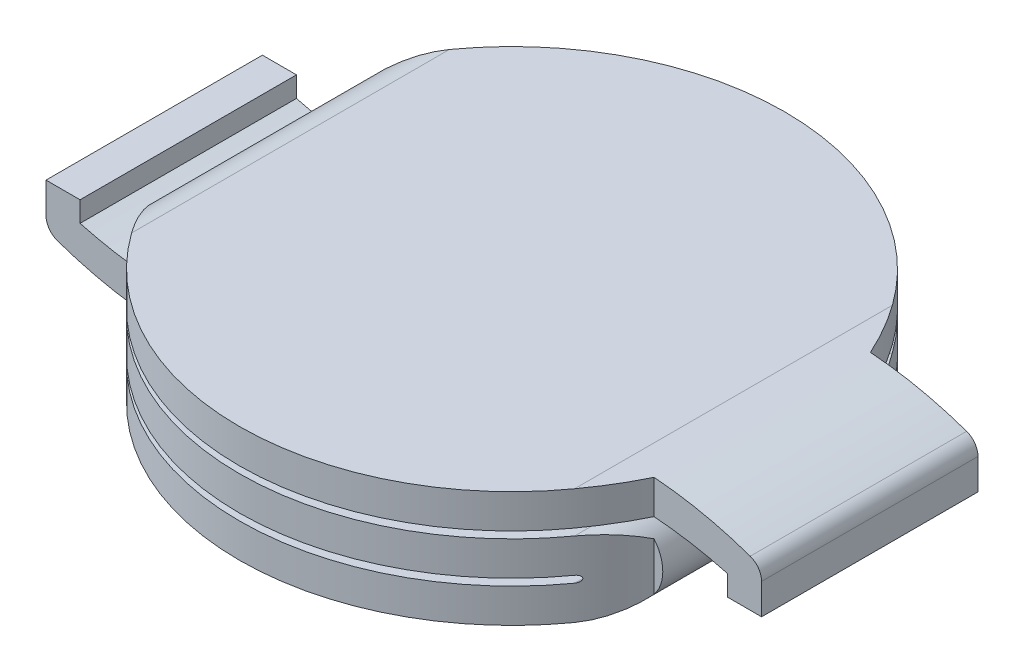
from build123d import *

# Parameters (mm, degrees)
BOSS_EXTRUDE1_DEPTH     = 16
CUT_EXTRUDE2_DEPTH      = 16
CUT_EXTRUDE2_DEPTH_BACK = 16
SKETCH2_R               = 16.202009592


with BuildPart() as part:
    # Sketch1 → Boss-Extrude1 (new body)
    with BuildSketch(Plane.XY):
        with BuildLine():
            Line((-6.5, -1.7), (6.5, -1.7))
            ThreePointArc((6.5, -1.7), (7.6, -0.6), (6.5, 0.5))
            Line((6.5, 0.5), (-6.5, 0.5))
            ThreePointArc((-6.5, 0.5), (-6.6, 0.6), (-6.5, 0.7))
            Line((-6.5, 0.7), (6.5, 0.7))
            ThreePointArc((6.5, 0.7), (8.013274595, 0.599559463), (9.5, 0.3))
            Line((9.5, 0.3), (9.5, -0.3))
            Line((9.5, -0.3), (10.5, -0.3))
            Line((10.5, -0.3), (10.5, 0.602011532))
            ThreePointArc((10.5, 0.602011532), (10.408046537, 0.890971778), (10.166007905, 1.073648442))
            ThreePointArc((10.166007905, 1.073648442), (8.359565153, 1.542285751), (6.5, 1.7))
            Line((6.5, 1.7), (-6.5, 1.7))
            ThreePointArc((-6.5, 1.7), (-7.6, 0.6), (-6.5, -0.5))
            Line((-6.5, -0.5), (6.5, -0.5))
            ThreePointArc((6.5, -0.5), (6.6, -0.6), (6.5, -0.7))
            Line((6.5, -0.7), (-6.5, -0.7))
            ThreePointArc((-6.5, -0.7), (-8.013274595, -0.599559463), (-9.5, -0.3))
            Line((-9.5, -0.3), (-9.5, 0.3))
            Line((-9.5, 0.3), (-10.5, 0.3))
            Line((-10.5, 0.3), (-10.5, -0.602011532))
            ThreePointArc((-10.5, -0.602011532), (-10.408046537, -0.890971778), (-10.166007905, -1.073648442))
            ThreePointArc((-10.166007905, -1.073648442), (-8.359565153, -1.542285751), (-6.5, -1.7))
        make_face()
    extrude(amount=BOSS_EXTRUDE1_DEPTH)

    # Sketch2 → Cut-Extrude2 (cut, two sides: drawn at the far end of the back side and taken through both)
    with BuildSketch(Plane(origin=(0, 1.7, 0), x_dir=(1, 0, 0), z_dir=(0, 1, 0)).offset(-CUT_EXTRUDE2_DEPTH_BACK)):
        with Locations((0, -8)):
            Circle(SKETCH2_R)
        with BuildLine():
            Line((-7.342981343, -11.175), (-10.5, -11.175))
            Line((-10.5, -11.175), (-10.5, -4.825))
            Line((-10.5, -4.825), (-7.342981343, -4.825))
            ThreePointArc((-7.342981343, -4.825), (0, 0), (7.342981343, -4.825))
            Line((7.342981343, -4.825), (10.5, -4.825))
            Line((10.5, -4.825), (10.5, -11.175))
            Line((10.5, -11.175), (7.342981343, -11.175))
            ThreePointArc((7.342981343, -11.175), (0, -16), (-7.342981343, -11.175))
        make_face(mode=Mode.SUBTRACT)
    extrude(amount=CUT_EXTRUDE2_DEPTH + CUT_EXTRUDE2_DEPTH_BACK, mode=Mode.SUBTRACT)


solid = part.part
